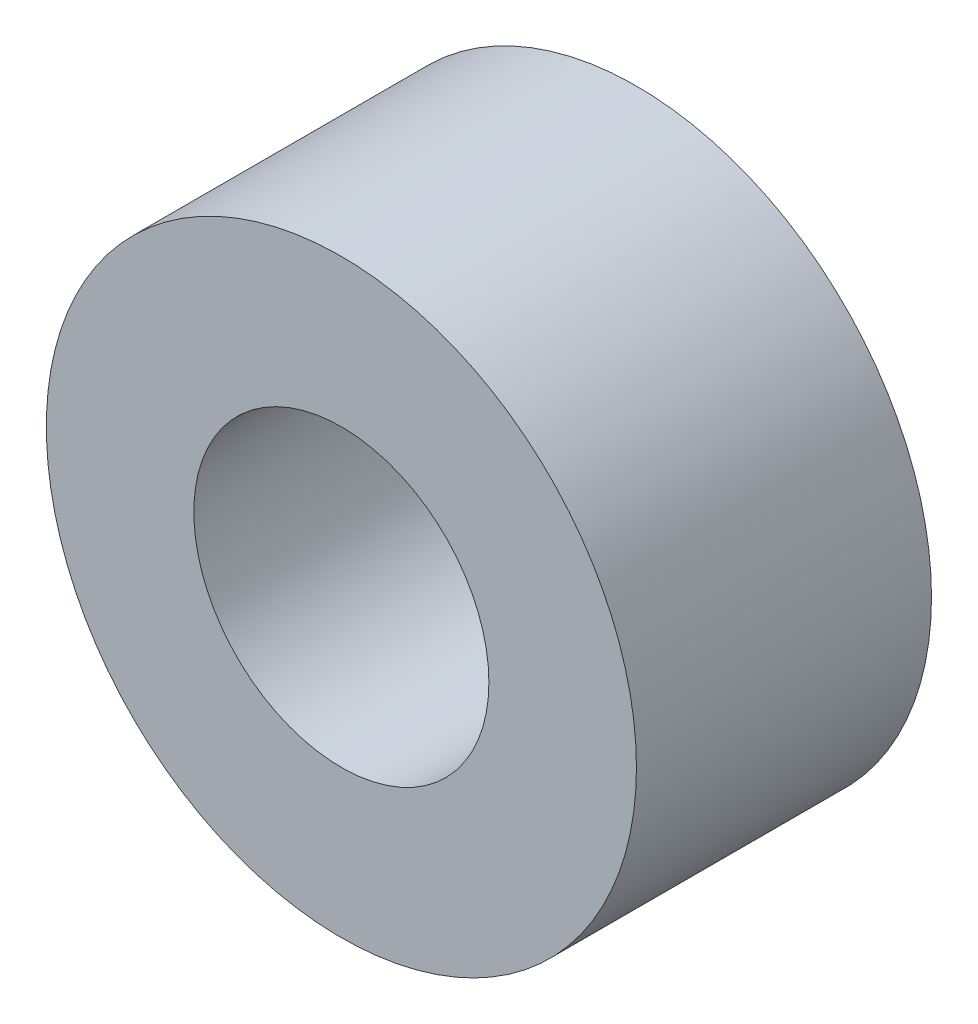
from build123d import *

# Parameters (mm, degrees)
ESQUISSE1_R        = 6.35
ESQUISSE1_R_2      = 3.175
BOSS_EXTRU_1_DEPTH = 6.35


with BuildPart() as part:
    # Esquisse1 → Boss.-Extru.1 (new body)
    with BuildSketch(Plane.XY):
        Circle(ESQUISSE1_R)
        Circle(ESQUISSE1_R_2, mode=Mode.SUBTRACT)
    extrude(amount=BOSS_EXTRU_1_DEPTH)


solid = part.part
